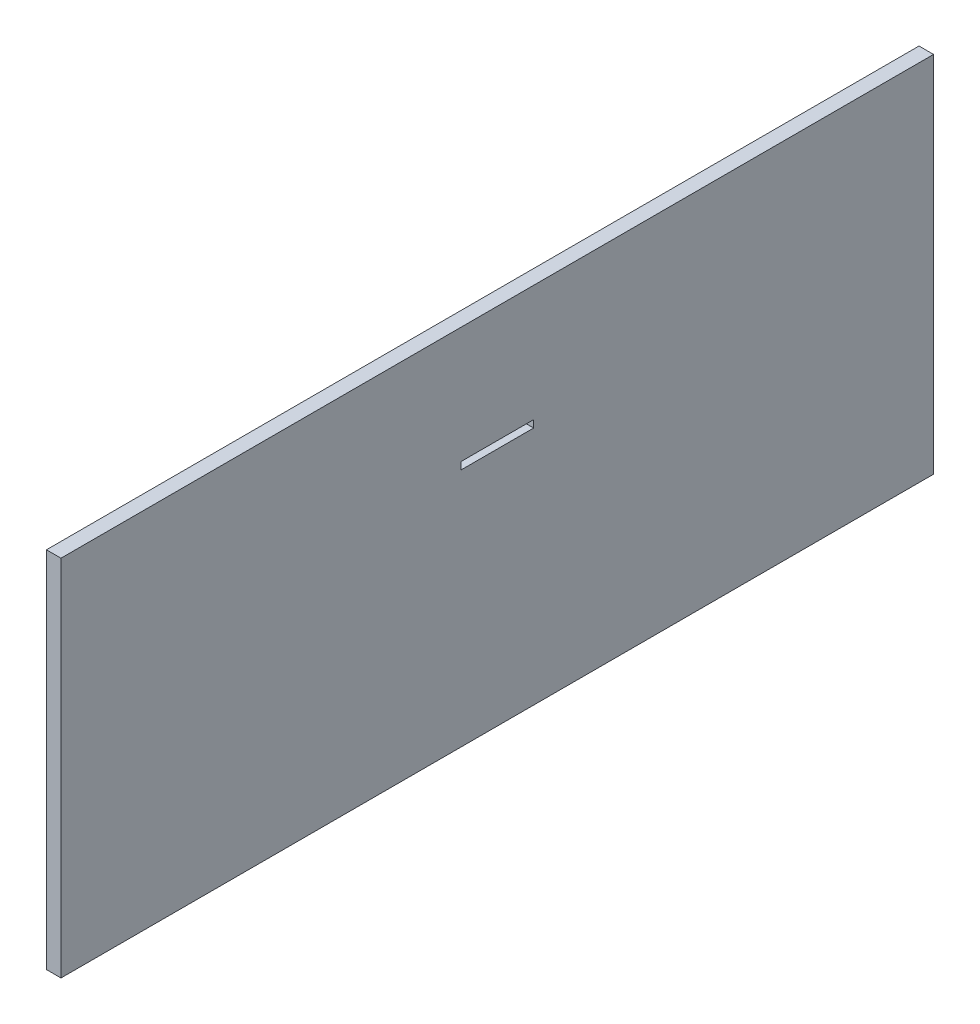
from build123d import *

# Parameters (mm, degrees)
SKETCH1_W           = 600
SKETCH1_H           = 250
SKETCH1_W_2         = 50
SKETCH1_H_2         = 5
BOSS_EXTRUDE1_DEPTH = 10


with BuildPart() as part:
    # Sketch1 → Boss-Extrude1 (new body)
    with BuildSketch(Plane(origin=(0, 0, 0), x_dir=(0, 0, -1), z_dir=(1, 0, 0))):
        with Locations((300, -117.764378479)):
            Rectangle(SKETCH1_W, SKETCH1_H)
        with Locations((300, -75.264378479)):
            Rectangle(SKETCH1_W_2, SKETCH1_H_2, mode=Mode.SUBTRACT)
    extrude(amount=BOSS_EXTRUDE1_DEPTH)


solid = part.part
